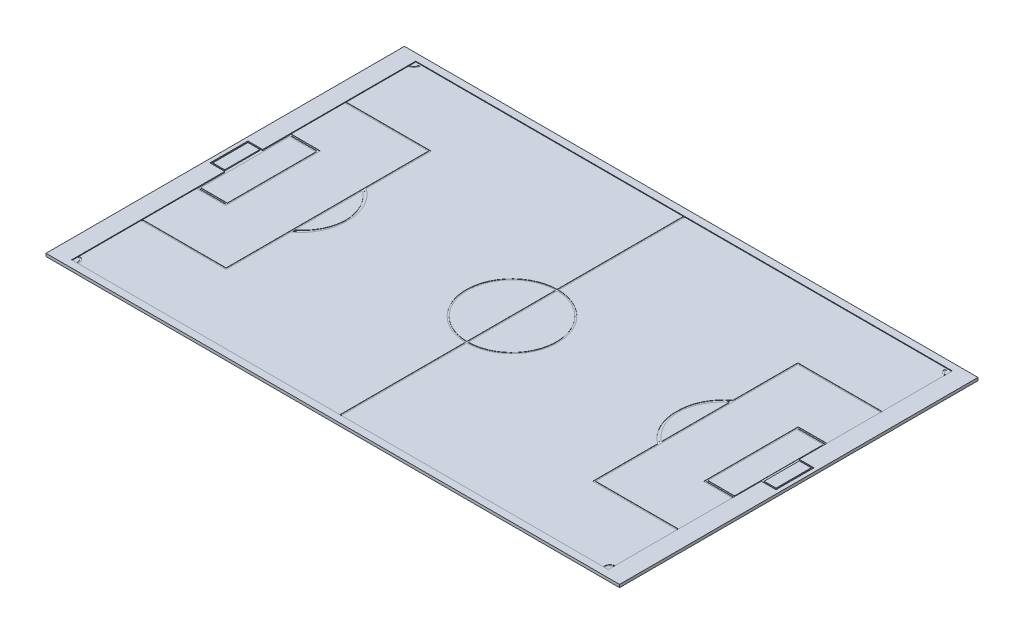
from build123d import *

# Parameters (mm, degrees)
SKETCH_1_W                  = 4000
SKETCH_1_H                  = 2500
EXTRUDE_1_DEPTH             = 20
SKETCH_3_W                  = 3739.524544905
SKETCH_3_H                  = 2389.140681467
CUT_EXTRUDE_1_DEPTH         = 5
CUT_EXTRUDE_3_DEPTH         = 2
SKETCH_5_W                  = 185
SKETCH_5_H                  = 629.140681467
SKETCH_5_W_2                = 83
SKETCH_5_H_2                = 245
CUT_EXTRUDE_5_DEPTH         = 2
SKETCH_7_W                  = 103
SKETCH_7_H                  = 265
SKETCH_7_W_2                = 83
SKETCH_7_H_2                = 245
CUT_EXTRUDE_6_DEPTH         = 5
CUT_EXTRUDE_16_DEPTH        = 2
SKETCH_9_3_R                = 320
SKETCH_9_3_R_2              = 310
CUT_EXTRUDE_17_DEPTH        = 2
CUT_EXTRUDE_18_DEPTH        = 2
MIRROR_3_COPY_1_SKETCH_W    = 3739.524544905
MIRROR_3_COPY_1_SKETCH_H    = 2389.140681467
MIRROR_3_COPY_1_DEPTH       = 5
MIRROR_3_COPY_2_DEPTH       = 2
MIRROR_3_COPY_3_SKETCH_W    = 185
MIRROR_3_COPY_3_SKETCH_H    = 629.140681467
MIRROR_3_COPY_3_SKETCH_W_2  = 83
MIRROR_3_COPY_3_SKETCH_H_2  = 245
MIRROR_3_COPY_3_DEPTH       = 2
MIRROR_3_COPY_4_SKETCH_W    = 103
MIRROR_3_COPY_4_SKETCH_H    = 265
MIRROR_3_COPY_4_SKETCH_W_2  = 83
MIRROR_3_COPY_4_SKETCH_H_2  = 245
MIRROR_3_COPY_4_DEPTH       = 5
MIRROR_3_COPY_5_DEPTH       = 2
MIRROR_3_COPY_6_SKETCH_R    = 320
MIRROR_3_COPY_6_SKETCH_R_2  = 310
MIRROR_3_COPY_6_DEPTH       = 2
MIRROR_3_COPY_7_DEPTH       = 2
MIRROR_3_COPY_8_SKETCH_W    = 3739.524544905
MIRROR_3_COPY_8_SKETCH_H    = 2389.140681467
MIRROR_3_COPY_8_DEPTH       = 5
MIRROR_3_COPY_9_DEPTH       = 2
MIRROR_3_COPY_10_SKETCH_W   = 185
MIRROR_3_COPY_10_SKETCH_H   = 629.140681467
MIRROR_3_COPY_10_SKETCH_W_2 = 83
MIRROR_3_COPY_10_SKETCH_H_2 = 245
MIRROR_3_COPY_10_DEPTH      = 2
MIRROR_3_COPY_11_SKETCH_W   = 103
MIRROR_3_COPY_11_SKETCH_H   = 265
MIRROR_3_COPY_11_SKETCH_W_2 = 83
MIRROR_3_COPY_11_SKETCH_H_2 = 245
MIRROR_3_COPY_11_DEPTH      = 5
MIRROR_3_COPY_12_DEPTH      = 2
MIRROR_3_COPY_13_SKETCH_R   = 320
MIRROR_3_COPY_13_SKETCH_R_2 = 310
MIRROR_3_COPY_13_DEPTH      = 2
MIRROR_3_COPY_14_DEPTH      = 2


with BuildPart() as part:
    # 草圖1 → 填料-伸長1 (new body)
    with BuildSketch(Plane(origin=(0, 0, 0), x_dir=(1, 0, 0), z_dir=(0, 1, 0))):
        Rectangle(SKETCH_1_W, SKETCH_1_H)
    extrude(amount=EXTRUDE_1_DEPTH)

    # 草圖3 → 除料-伸長1 (cut)
    with BuildSketch(Plane(origin=(0, 20, 0), x_dir=(1, 0, 0), z_dir=(0, 1, 0))):
        with Locations((1.30793571, -5.356728769)):
            Rectangle(SKETCH_3_W, SKETCH_3_H)
    cut_extrude_1 = extrude(amount=-CUT_EXTRUDE_1_DEPTH, mode=Mode.SUBTRACT)

    # 草圖4 → 除料-伸長3 (cut)
    with BuildSketch(Plane(origin=(0, 15, 0), x_dir=(1, 0, 0), z_dir=(0, 1, 0))):
        Polygon((-1868.454336743, 715), (-1288.454336743, 715), (-1278.454336743, 715), (-1278.454336743, -715), (-1868.454336743, -715), (-1868.454336743, -705), (-1288.454336743, -705), (-1288.454336743, 705), (-1868.454336743, 705), align=None)
    cut_extrude_3 = extrude(amount=-CUT_EXTRUDE_3_DEPTH, mode=Mode.SUBTRACT)

    # 草圖5 → 除料-伸長5 (cut)
    with BuildSketch(Plane(origin=(0, 15, 0), x_dir=(1, 0, 0), z_dir=(0, 1, 0))):
        Polygon((1871.070208162, 319.213611964), (1666.070208162, 319.213611964), (1666.070208162, -329.927069503), (1871.070208162, -329.927069503), (1871.070208162, -132.5), (1974.070208162, -132.5), (1974.070208162, 132.5), (1871.070208162, 132.5), align=None)
        with Locations((1768.570208162, -5.35672877)):
            Rectangle(SKETCH_5_W, SKETCH_5_H, mode=Mode.SUBTRACT)
        with Locations((1922.570208162, 0)):
            Rectangle(SKETCH_5_W_2, SKETCH_5_H_2, mode=Mode.SUBTRACT)
    cut_extrude_5 = extrude(amount=-CUT_EXTRUDE_5_DEPTH, mode=Mode.SUBTRACT)

    # 草圖7 → 除料-伸長6 (cut)
    with BuildSketch(Plane(origin=(0, 20, 0), x_dir=(1, 0, 0), z_dir=(0, 1, 0))):
        with Locations((1922.570208162, 0)):
            Rectangle(SKETCH_7_W, SKETCH_7_H)
        with Locations((1922.570208162, 0)):
            Rectangle(SKETCH_7_W_2, SKETCH_7_H_2, mode=Mode.SUBTRACT)
    cut_extrude_6 = extrude(amount=-CUT_EXTRUDE_6_DEPTH, mode=Mode.SUBTRACT)

    # 草圖9 → 除料-伸長16 (cut)
    with BuildSketch(Plane(origin=(0, 15, 0), x_dir=(1, 0, 0), z_dir=(0, 1, 0))):
        with BuildLine():
            ThreePointArc((-1278.454336743, -262.485638384), (-1149.264370393, -6.557696493), (-1278.454336743, 249.370245398))
            Line((-1278.454336743, 249.370245398), (-1278.454336743, 236.829294479))
            ThreePointArc((-1278.454336743, 236.829294479), (-1159.264370393, -6.557696493), (-1278.454336743, -249.944687465))
            Line((-1278.454336743, -249.944687465), (-1278.454336743, -262.485638384))
        make_face()
    cut_extrude_16 = extrude(amount=-CUT_EXTRUDE_16_DEPTH, mode=Mode.SUBTRACT)

    # 草圖9<3> → 除料-伸長17 (cut)
    with BuildSketch(Plane(origin=(0, 15, 0), x_dir=(1, 0, 0), z_dir=(0, 1, 0))):
        Circle(SKETCH_9_3_R)
        Circle(SKETCH_9_3_R_2, mode=Mode.SUBTRACT)
    cut_extrude_17 = extrude(amount=-CUT_EXTRUDE_17_DEPTH, mode=Mode.SUBTRACT)

    # 草圖9<4> → 除料-伸長18 (cut)
    with BuildSketch(Plane(origin=(0, 15, 0), x_dir=(1, 0, 0), z_dir=(0, 1, 0))):
        with BuildLine():
            ThreePointArc((-1868.454336743, 1147.192515671), (-1841.094059669, 1160.474906139), (-1831.139490585, 1189.213611964))
            Line((-1831.139490585, 1189.213611964), (-1841.121942258, 1188.621447643))
            ThreePointArc((-1841.121942258, 1188.621447643), (-1848.37548107, 1167.337749028), (-1868.454336743, 1157.216029468))
            Line((-1868.454336743, 1157.216029468), (-1868.454336743, 1147.192515671))
        make_face()
        with BuildLine():
            Line((5, 319.960935116), (5, 1189.213611964))
            Line((5, 1189.213611964), (-5, 1189.213611964))
            Line((-5, 1189.213611964), (-5, 319.960935116))
            ThreePointArc((-5, 319.960935116), (0, 320), (5, 319.960935116))
        make_face()
        with BuildLine():
            Line((5, -309.959674797), (5, 309.959674797))
            ThreePointArc((5, 309.959674797), (0, 310), (-5, 309.959674797))
            Line((-5, 309.959674797), (-5, -309.959674797))
            ThreePointArc((-5, -309.959674797), (0, -310), (5, -309.959674797))
        make_face()
        with BuildLine():
            ThreePointArc((5, -319.960935116), (0, -320), (-5, -319.960935116))
            Line((-5, -319.960935116), (-5, -1199.927069503))
            Line((-5, -1199.927069503), (5, -1199.927069503))
            Line((5, -1199.927069503), (5, -319.960935116))
        make_face()
    cut_extrude_18 = extrude(amount=-CUT_EXTRUDE_18_DEPTH, mode=Mode.SUBTRACT)

    # 鏡射1: 除料-伸長1, 除料-伸長3, 除料-伸長5, 除料-伸長6, 除料-伸長16, 除料-伸長17, 除料-伸長18 across plane
    add(cut_extrude_1.mirror(Plane(origin=(0, 0, 0), x_dir=(0, 0, 1), z_dir=(1, 0, 0))), mode=Mode.SUBTRACT)
    add(cut_extrude_3.mirror(Plane(origin=(0, 0, 0), x_dir=(0, 0, 1), z_dir=(1, 0, 0))), mode=Mode.SUBTRACT)
    add(cut_extrude_5.mirror(Plane(origin=(0, 0, 0), x_dir=(0, 0, 1), z_dir=(1, 0, 0))), mode=Mode.SUBTRACT)
    add(cut_extrude_6.mirror(Plane(origin=(0, 0, 0), x_dir=(0, 0, 1), z_dir=(1, 0, 0))), mode=Mode.SUBTRACT)
    add(cut_extrude_16.mirror(Plane(origin=(0, 0, 0), x_dir=(0, 0, 1), z_dir=(1, 0, 0))), mode=Mode.SUBTRACT)
    add(cut_extrude_17.mirror(Plane(origin=(0, 0, 0), x_dir=(0, 0, 1), z_dir=(1, 0, 0))), mode=Mode.SUBTRACT)
    add(cut_extrude_18.mirror(Plane(origin=(0, 0, 0), x_dir=(0, 0, 1), z_dir=(1, 0, 0))), mode=Mode.SUBTRACT)

    # 鏡射3 copy 1 sketch → 鏡射3 copy 1 (cut)
    with BuildSketch(Plane(origin=(0, 20, 0), x_dir=(-1, 0, 0), z_dir=(0, 1, 0))):
        with Locations((1.30793571, -5.356728769)):
            Rectangle(MIRROR_3_COPY_1_SKETCH_W, MIRROR_3_COPY_1_SKETCH_H)
    extrude(amount=-MIRROR_3_COPY_1_DEPTH, mode=Mode.SUBTRACT)

    # 鏡射3 copy 2 sketch → 鏡射3 copy 2 (cut)
    with BuildSketch(Plane(origin=(0, 15, 0), x_dir=(-1, 0, 0), z_dir=(0, 1, 0))):
        Polygon((-1868.454336743, 715), (-1288.454336743, 715), (-1278.454336743, 715), (-1278.454336743, -715), (-1868.454336743, -715), (-1868.454336743, -705), (-1288.454336743, -705), (-1288.454336743, 705), (-1868.454336743, 705), align=None)
    extrude(amount=-MIRROR_3_COPY_2_DEPTH, mode=Mode.SUBTRACT)

    # 鏡射3 copy 3 sketch → 鏡射3 copy 3 (cut)
    with BuildSketch(Plane(origin=(0, 15, 0), x_dir=(-1, 0, 0), z_dir=(0, 1, 0))):
        Polygon((1871.070208162, 319.213611964), (1666.070208162, 319.213611964), (1666.070208162, -329.927069503), (1871.070208162, -329.927069503), (1871.070208162, -132.5), (1974.070208162, -132.5), (1974.070208162, 132.5), (1871.070208162, 132.5), align=None)
        with Locations((1768.570208162, -5.35672877)):
            Rectangle(MIRROR_3_COPY_3_SKETCH_W, MIRROR_3_COPY_3_SKETCH_H, mode=Mode.SUBTRACT)
        with Locations((1922.570208162, 0)):
            Rectangle(MIRROR_3_COPY_3_SKETCH_W_2, MIRROR_3_COPY_3_SKETCH_H_2, mode=Mode.SUBTRACT)
    extrude(amount=-MIRROR_3_COPY_3_DEPTH, mode=Mode.SUBTRACT)

    # 鏡射3 copy 4 sketch → 鏡射3 copy 4 (cut)
    with BuildSketch(Plane(origin=(0, 20, 0), x_dir=(-1, 0, 0), z_dir=(0, 1, 0))):
        with Locations((1922.570208162, 0)):
            Rectangle(MIRROR_3_COPY_4_SKETCH_W, MIRROR_3_COPY_4_SKETCH_H)
        with Locations((1922.570208162, 0)):
            Rectangle(MIRROR_3_COPY_4_SKETCH_W_2, MIRROR_3_COPY_4_SKETCH_H_2, mode=Mode.SUBTRACT)
    extrude(amount=-MIRROR_3_COPY_4_DEPTH, mode=Mode.SUBTRACT)

    # 鏡射3 copy 5 sketch → 鏡射3 copy 5 (cut)
    with BuildSketch(Plane(origin=(0, 15, 0), x_dir=(-1, 0, 0), z_dir=(0, 1, 0))):
        with BuildLine():
            ThreePointArc((-1278.454336743, -262.485638384), (-1149.264370393, -6.557696493), (-1278.454336743, 249.370245398))
            Line((-1278.454336743, 249.370245398), (-1278.454336743, 236.829294479))
            ThreePointArc((-1278.454336743, 236.829294479), (-1159.264370393, -6.557696493), (-1278.454336743, -249.944687465))
            Line((-1278.454336743, -249.944687465), (-1278.454336743, -262.485638384))
        make_face()
    extrude(amount=-MIRROR_3_COPY_5_DEPTH, mode=Mode.SUBTRACT)

    # 鏡射3 copy 6 sketch → 鏡射3 copy 6 (cut)
    with BuildSketch(Plane(origin=(0, 15, 0), x_dir=(-1, 0, 0), z_dir=(0, 1, 0))):
        Circle(MIRROR_3_COPY_6_SKETCH_R)
        Circle(MIRROR_3_COPY_6_SKETCH_R_2, mode=Mode.SUBTRACT)
    extrude(amount=-MIRROR_3_COPY_6_DEPTH, mode=Mode.SUBTRACT)

    # 鏡射3 copy 7 sketch → 鏡射3 copy 7 (cut)
    with BuildSketch(Plane(origin=(0, 15, 0), x_dir=(-1, 0, 0), z_dir=(0, 1, 0))):
        with BuildLine():
            ThreePointArc((-1868.454336743, 1147.192515671), (-1841.094059669, 1160.474906139), (-1831.139490585, 1189.213611964))
            Line((-1831.139490585, 1189.213611964), (-1841.121942258, 1188.621447643))
            ThreePointArc((-1841.121942258, 1188.621447643), (-1848.37548107, 1167.337749028), (-1868.454336743, 1157.216029468))
            Line((-1868.454336743, 1157.216029468), (-1868.454336743, 1147.192515671))
        make_face()
        with BuildLine():
            Line((5, 319.960935116), (5, 1189.213611964))
            Line((5, 1189.213611964), (-5, 1189.213611964))
            Line((-5, 1189.213611964), (-5, 319.960935116))
            ThreePointArc((-5, 319.960935116), (0, 320), (5, 319.960935116))
        make_face()
        with BuildLine():
            Line((5, -309.959674797), (5, 309.959674797))
            ThreePointArc((5, 309.959674797), (0, 310), (-5, 309.959674797))
            Line((-5, 309.959674797), (-5, -309.959674797))
            ThreePointArc((-5, -309.959674797), (0, -310), (5, -309.959674797))
        make_face()
        with BuildLine():
            ThreePointArc((5, -319.960935116), (0, -320), (-5, -319.960935116))
            Line((-5, -319.960935116), (-5, -1199.927069503))
            Line((-5, -1199.927069503), (5, -1199.927069503))
            Line((5, -1199.927069503), (5, -319.960935116))
        make_face()
    extrude(amount=-MIRROR_3_COPY_7_DEPTH, mode=Mode.SUBTRACT)

    # 鏡射3 copy 8 sketch → 鏡射3 copy 8 (cut)
    with BuildSketch(Plane(origin=(0, 20, 0), x_dir=(1, 0, 0), z_dir=(0, 1, 0))):
        with Locations((1.30793571, 5.356728769)):
            Rectangle(MIRROR_3_COPY_8_SKETCH_W, MIRROR_3_COPY_8_SKETCH_H)
    extrude(amount=-MIRROR_3_COPY_8_DEPTH, mode=Mode.SUBTRACT)

    # 鏡射3 copy 9 sketch → 鏡射3 copy 9 (cut)
    with BuildSketch(Plane(origin=(0, 15, 0), x_dir=(1, 0, 0), z_dir=(0, 1, 0))):
        Polygon((-1868.454336743, -715), (-1288.454336743, -715), (-1278.454336743, -715), (-1278.454336743, 715), (-1868.454336743, 715), (-1868.454336743, 705), (-1288.454336743, 705), (-1288.454336743, -705), (-1868.454336743, -705), align=None)
    extrude(amount=-MIRROR_3_COPY_9_DEPTH, mode=Mode.SUBTRACT)

    # 鏡射3 copy 10 sketch → 鏡射3 copy 10 (cut)
    with BuildSketch(Plane(origin=(0, 15, 0), x_dir=(1, 0, 0), z_dir=(0, 1, 0))):
        Polygon((1871.070208162, -319.213611964), (1666.070208162, -319.213611964), (1666.070208162, 329.927069503), (1871.070208162, 329.927069503), (1871.070208162, 132.5), (1974.070208162, 132.5), (1974.070208162, -132.5), (1871.070208162, -132.5), align=None)
        with Locations((1768.570208162, 5.35672877)):
            Rectangle(MIRROR_3_COPY_10_SKETCH_W, MIRROR_3_COPY_10_SKETCH_H, mode=Mode.SUBTRACT)
        with Locations((1922.570208162, 0)):
            Rectangle(MIRROR_3_COPY_10_SKETCH_W_2, MIRROR_3_COPY_10_SKETCH_H_2, mode=Mode.SUBTRACT)
    extrude(amount=-MIRROR_3_COPY_10_DEPTH, mode=Mode.SUBTRACT)

    # 鏡射3 copy 11 sketch → 鏡射3 copy 11 (cut)
    with BuildSketch(Plane(origin=(0, 20, 0), x_dir=(1, 0, 0), z_dir=(0, 1, 0))):
        with Locations((1922.570208162, 0)):
            Rectangle(MIRROR_3_COPY_11_SKETCH_W, MIRROR_3_COPY_11_SKETCH_H)
        with Locations((1922.570208162, 0)):
            Rectangle(MIRROR_3_COPY_11_SKETCH_W_2, MIRROR_3_COPY_11_SKETCH_H_2, mode=Mode.SUBTRACT)
    extrude(amount=-MIRROR_3_COPY_11_DEPTH, mode=Mode.SUBTRACT)

    # 鏡射3 copy 12 sketch → 鏡射3 copy 12 (cut)
    with BuildSketch(Plane(origin=(0, 15, 0), x_dir=(1, 0, 0), z_dir=(0, 1, 0))):
        with BuildLine():
            ThreePointArc((-1278.454336743, 262.485638384), (-1149.264370393, 6.557696493), (-1278.454336743, -249.370245398))
            Line((-1278.454336743, -249.370245398), (-1278.454336743, -236.829294479))
            ThreePointArc((-1278.454336743, -236.829294479), (-1159.264370393, 6.557696493), (-1278.454336743, 249.944687465))
            Line((-1278.454336743, 249.944687465), (-1278.454336743, 262.485638384))
        make_face()
    extrude(amount=-MIRROR_3_COPY_12_DEPTH, mode=Mode.SUBTRACT)

    # 鏡射3 copy 13 sketch → 鏡射3 copy 13 (cut)
    with BuildSketch(Plane(origin=(0, 15, 0), x_dir=(1, 0, 0), z_dir=(0, 1, 0))):
        Circle(MIRROR_3_COPY_13_SKETCH_R)
        Circle(MIRROR_3_COPY_13_SKETCH_R_2, mode=Mode.SUBTRACT)
    extrude(amount=-MIRROR_3_COPY_13_DEPTH, mode=Mode.SUBTRACT)

    # 鏡射3 copy 14 sketch → 鏡射3 copy 14 (cut)
    with BuildSketch(Plane(origin=(0, 15, 0), x_dir=(1, 0, 0), z_dir=(0, 1, 0))):
        with BuildLine():
            ThreePointArc((-1868.454336743, -1147.192515671), (-1841.094059669, -1160.474906139), (-1831.139490585, -1189.213611964))
            Line((-1831.139490585, -1189.213611964), (-1841.121942258, -1188.621447643))
            ThreePointArc((-1841.121942258, -1188.621447643), (-1848.37548107, -1167.337749028), (-1868.454336743, -1157.216029468))
            Line((-1868.454336743, -1157.216029468), (-1868.454336743, -1147.192515671))
        make_face()
        with BuildLine():
            Line((5, -319.960935116), (5, -1189.213611964))
            Line((5, -1189.213611964), (-5, -1189.213611964))
            Line((-5, -1189.213611964), (-5, -319.960935116))
            ThreePointArc((-5, -319.960935116), (0, -320), (5, -319.960935116))
        make_face()
        with BuildLine():
            Line((5, 309.959674797), (5, -309.959674797))
            ThreePointArc((5, -309.959674797), (0, -310), (-5, -309.959674797))
            Line((-5, -309.959674797), (-5, 309.959674797))
            ThreePointArc((-5, 309.959674797), (0, 310), (5, 309.959674797))
        make_face()
        with BuildLine():
            ThreePointArc((5, 319.960935116), (0, 320), (-5, 319.960935116))
            Line((-5, 319.960935116), (-5, 1199.927069503))
            Line((-5, 1199.927069503), (5, 1199.927069503))
            Line((5, 1199.927069503), (5, 319.960935116))
        make_face()
    extrude(amount=-MIRROR_3_COPY_14_DEPTH, mode=Mode.SUBTRACT)


solid = part.part
